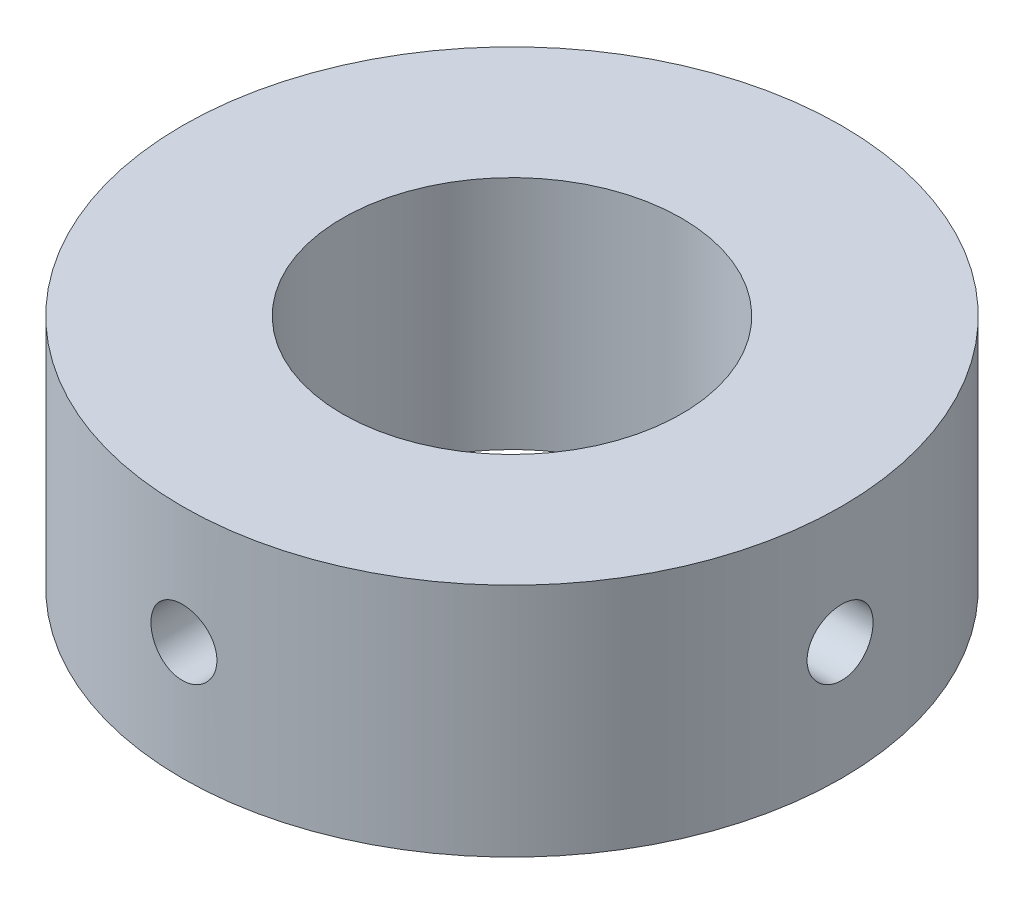
from build123d import *

# Parameters (mm, degrees)
SKETCH1_R               = 8.89
SKETCH1_R_2             = 4.572
BOSS_EXTRUDE1_DEPTH     = 6.35
CUT_EXTRUDE1_REACH      = 16.085
CUT_EXTRUDE1_END_RADIUS = 8.89
SKETCH2_R               = 0.889
CUT_EXTRUDE2_REACH      = 16.085
CUT_EXTRUDE2_END_RADIUS = 8.89
SKETCH3_R               = 0.889


with BuildPart() as part:
    # Sketch1 → Boss-Extrude1 (new body)
    with BuildSketch(Plane(origin=(0, 0, 0), x_dir=(1, 0, 0), z_dir=(0, 1, 0))):
        with Locations(Location((0, 0, 0), (0, 0, 270))):
            Circle(SKETCH1_R)
        with Locations(Location((0, 0, 0), (0, 0, 270))):
            Circle(SKETCH1_R_2, mode=Mode.SUBTRACT)
    extrude(amount=BOSS_EXTRUDE1_DEPTH)

    # Cut-Extrude1: up to this cylinder (the profile starts inside it)
    cut_extrude1_end = Plane(origin=(0, 3.175, 0), z_dir=(0, -1, 0)) * Cylinder(CUT_EXTRUDE1_END_RADIUS, 50.95, mode=Mode.PRIVATE)
    # Sketch2 → Cut-Extrude1 (cut, up to the surface)
    with BuildSketch(Plane(origin=(0, 0, 0), x_dir=(0, 0, -1), z_dir=(1, 0, 0)), mode=Mode.PRIVATE) as cut_extrude1_sk1:
        with Locations(Location((0, 3.175, 0), (0, 0, 180))):
            Circle(SKETCH2_R)
    cut_extrude1_tool1 = extrude(cut_extrude1_sk1.sketch, amount=CUT_EXTRUDE1_REACH, mode=Mode.PRIVATE) & cut_extrude1_end
    add(cut_extrude1_tool1.solids().sort_by_distance((0, 3.175, 0))[0], mode=Mode.SUBTRACT)

    # Cut-Extrude2: up to this cylinder (the profile starts inside it)
    cut_extrude2_end = Plane(origin=(0, 3.175, 0), z_dir=(0, -1, 0)) * Cylinder(CUT_EXTRUDE2_END_RADIUS, 50.95, mode=Mode.PRIVATE)
    # Sketch3 → Cut-Extrude2 (cut, up to the surface)
    with BuildSketch(Plane.XY, mode=Mode.PRIVATE) as cut_extrude2_sk1:
        with Locations(Location((0, 3.175, 0), (0, 0, 180))):
            Circle(SKETCH3_R)
    cut_extrude2_tool1 = extrude(cut_extrude2_sk1.sketch, amount=CUT_EXTRUDE2_REACH, mode=Mode.PRIVATE) & cut_extrude2_end
    add(cut_extrude2_tool1.solids().sort_by_distance((0, 3.175, 0))[0], mode=Mode.SUBTRACT)


solid = part.part
